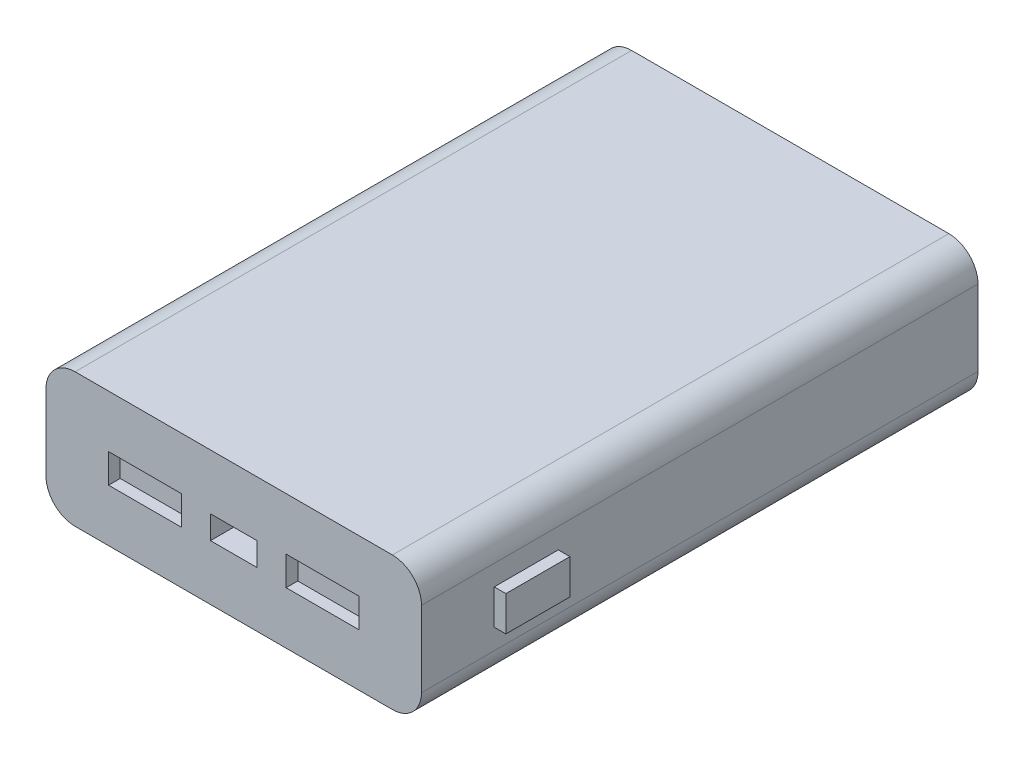
from build123d import *

# Parameters (mm, degrees)
SKETCH1_W           = 64.5
SKETCH1_H           = 23
BOSS_EXTRUDE1_DEPTH = 95.6
FILLET1_R           = 5
SKETCH2_W           = 8
SKETCH2_H           = 4
CUT_EXTRUDE1_DEPTH  = 5
SKETCH3_W           = 11
SKETCH3_H           = 6
BOSS_EXTRUDE2_DEPTH = 2
SKETCH4_W           = 12.5
SKETCH4_H           = 5
CUT_EXTRUDE2_DEPTH  = 2
SKETCH5_W           = 17
SKETCH5_H           = 13
CUT_EXTRUDE3_DEPTH  = 2


with BuildPart() as part:
    # Sketch1 → Boss-Extrude1 (new body)
    with BuildSketch(Plane.XY):
        Rectangle(SKETCH1_W, SKETCH1_H)
    extrude(amount=BOSS_EXTRUDE1_DEPTH)

    # Fillet1
    fillet1_edges = [part.edges().sort_by_distance(p)[0] for p in [
        (32.25, -11.5, 47.8),
        (-32.25, -11.5, 47.8),
        (-32.25, 11.5, 47.8),
        (32.25, 11.5, 47.8),
    ]]
    fillet(fillet1_edges, radius=FILLET1_R)

    # Sketch2 → Cut-Extrude1 (cut)
    with BuildSketch(Plane.XY.offset(95.6)):
        Rectangle(SKETCH2_W, SKETCH2_H)
    extrude(amount=-CUT_EXTRUDE1_DEPTH, mode=Mode.SUBTRACT)

    # Sketch4 → Cut-Extrude2 (cut)
    with BuildSketch(Plane.XY.offset(95.6)):
        with Locations((-15.25, 0)):
            Rectangle(SKETCH4_W, SKETCH4_H)
        with Locations((15.25, 0)):
            Rectangle(SKETCH4_W, SKETCH4_H)
    extrude(amount=-CUT_EXTRUDE2_DEPTH, mode=Mode.SUBTRACT)

    # Sketch5 → Cut-Extrude3 (cut)
    with BuildSketch(Plane.XZ.offset(11.5)):
        with Locations((16.25, 79.6)):
            Rectangle(SKETCH5_W, SKETCH5_H)
    extrude(amount=-CUT_EXTRUDE3_DEPTH, mode=Mode.SUBTRACT)


with BuildPart() as body_2:
    # Sketch3 → Boss-Extrude2 (new body)
    with BuildSketch(Plane(origin=(32.25, 0, 0), x_dir=(0, 0, -1), z_dir=(1, 0, 0))):
        with Locations((-77.6, 0)):
            Rectangle(SKETCH3_W, SKETCH3_H)
    extrude(amount=BOSS_EXTRUDE2_DEPTH)


solid = Compound([part.part, body_2.part])
